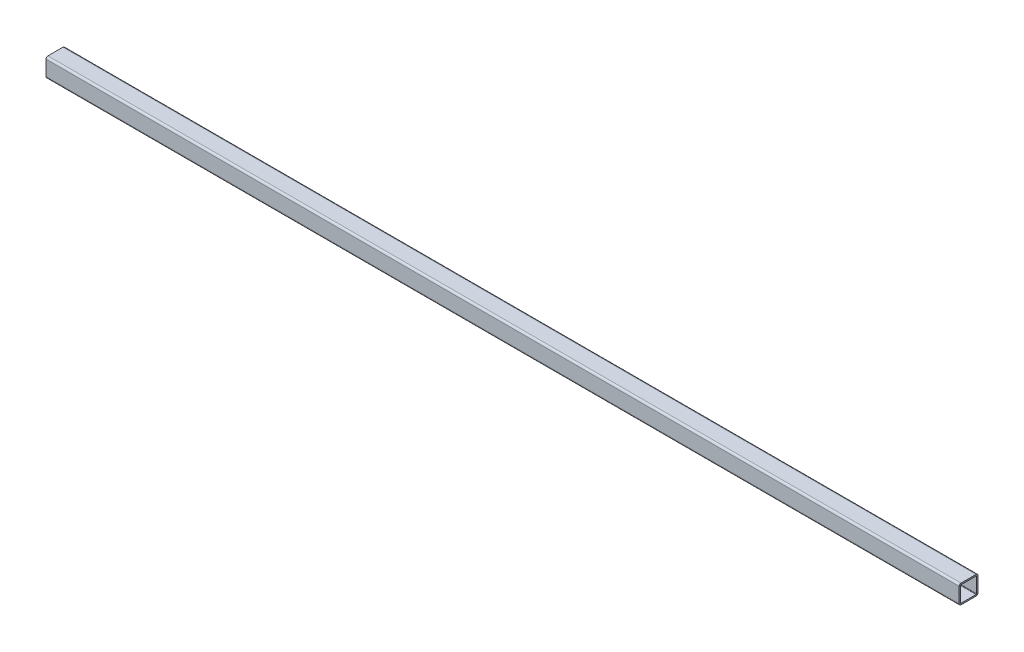
from build123d import *

# Parameters (mm, degrees)
F_2_X_2_X_0_25_1_DEPTH = 969


with BuildPart() as part:
    # Sketch1 → Квадратная труба 2 X 2 X 0.25(1) (new body)
    with BuildSketch(Plane.YZ.offset(-484.5)):
        with BuildLine():
            Line((-8, -10), (8, -10))
            ThreePointArc((8, -10), (9.414213562, -9.414213562), (10, -8))
            Line((10, -8), (10, 8))
            ThreePointArc((10, 8), (9.414213562, 9.414213562), (8, 10))
            Line((8, 10), (-8, 10))
            ThreePointArc((-8, 10), (-9.414213562, 9.414213562), (-10, 8))
            Line((-10, 8), (-10, -8))
            ThreePointArc((-10, -8), (-9.414213562, -9.414213562), (-8, -10))
        make_face()
        with BuildLine():
            Line((-8, -8.5), (8, -8.5))
            ThreePointArc((8, -8.5), (8.353553391, -8.353553391), (8.5, -8))
            Line((8.5, -8), (8.5, 8))
            ThreePointArc((8.5, 8), (8.353553391, 8.353553391), (8, 8.5))
            Line((8, 8.5), (-8, 8.5))
            ThreePointArc((-8, 8.5), (-8.353553391, 8.353553391), (-8.5, 8))
            Line((-8.5, 8), (-8.5, -8))
            ThreePointArc((-8.5, -8), (-8.353553391, -8.353553391), (-8, -8.5))
        make_face(mode=Mode.SUBTRACT)
    extrude(amount=F_2_X_2_X_0_25_1_DEPTH)


solid = part.part
